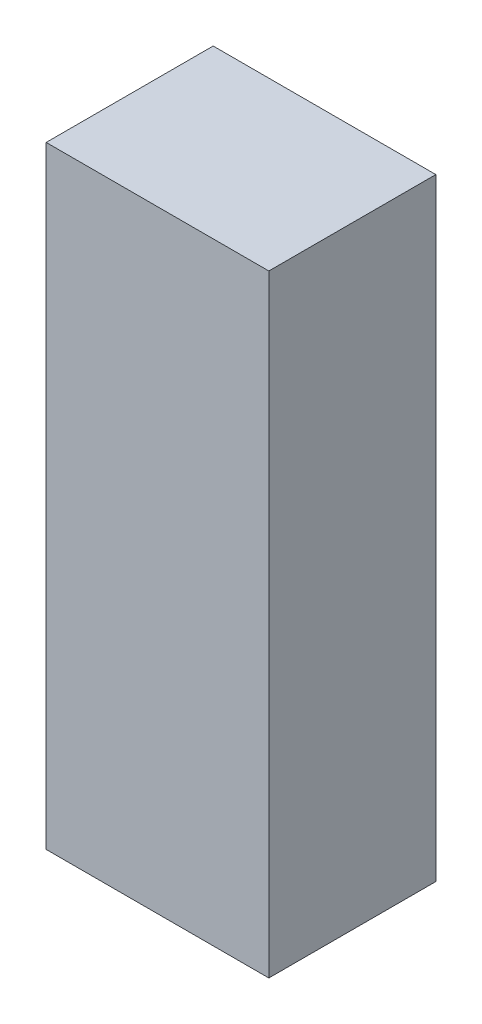
from build123d import *

# Parameters (mm, degrees)
SKETCH1_W           = 400
SKETCH1_H           = 300
BOSS_EXTRUDE1_DEPTH = 1100


with BuildPart() as part:
    # Sketch1 → Boss-Extrude1 (new body)
    with BuildSketch(Plane(origin=(0, -3900, 0), x_dir=(1, 0, 0), z_dir=(0, 1, 0))):
        with Locations((-200, -150)):
            Rectangle(SKETCH1_W, SKETCH1_H)
    extrude(amount=BOSS_EXTRUDE1_DEPTH)


solid = part.part
